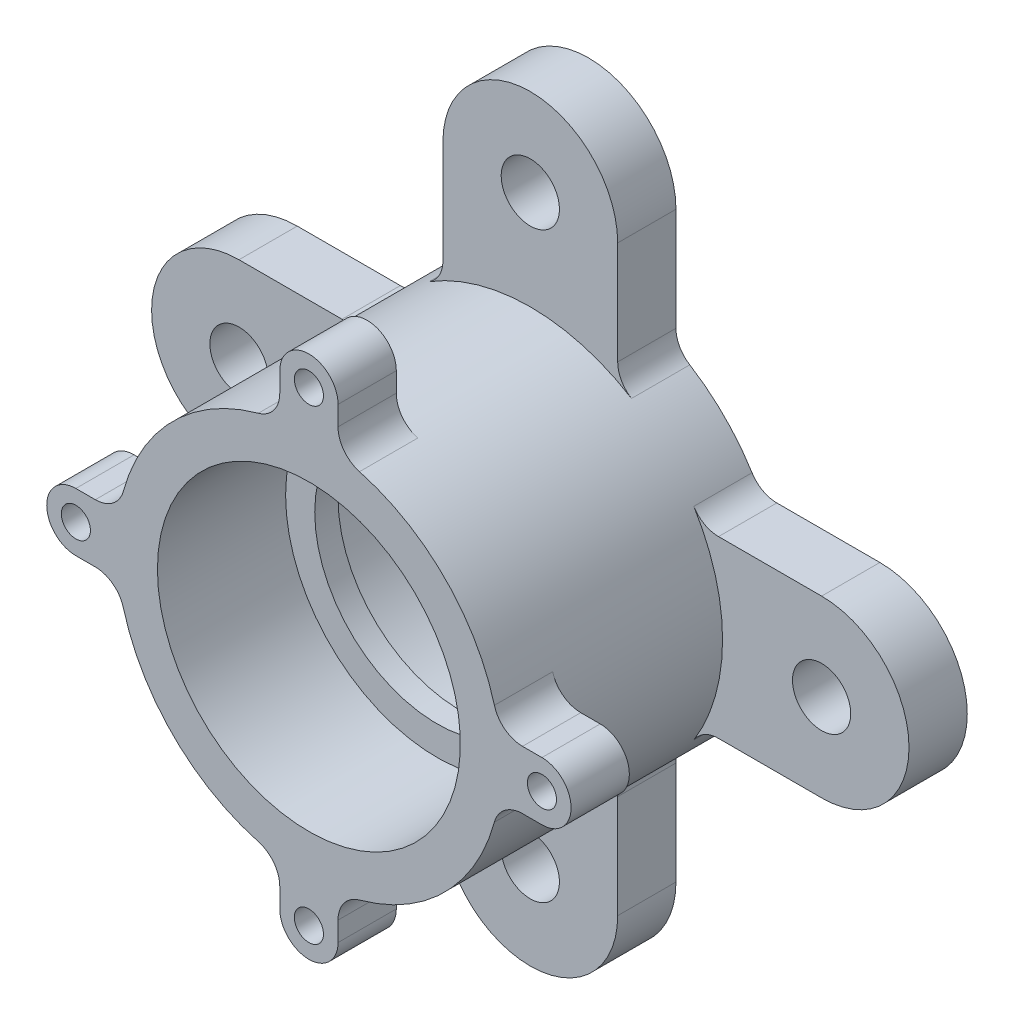
from build123d import *

# Parameters (mm, degrees)
SKETCH2_W           = 5
SKETCH2_H           = 4
BOSS_EXTRUDE1_START = -10
BOSS_EXTRUDE1_DEPTH = 10
SKETCH4_R           = 2.5
BOSS_EXTRUDE2_DEPTH = 10
FILLET1_R           = 5


with BuildPart() as part:
    # Sketch2 → Revolve1 (revolve)
    with BuildSketch(Plane(origin=(0, 0, 0), x_dir=(-1, 0, 0), z_dir=(0, 1, 0))):
        with Locations((23.5, 24)):
            Rectangle(SKETCH2_W, SKETCH2_H)
        Polygon((26, 22), (26, 0), (33, 0), (33, 48), (26, 48), (26, 26), align=None)
    revolve(axis=Axis((0, 0, 0), (0, 0, 1)))

    # Sketch3 → Boss-Extrude1 (add)
    with BuildSketch(Plane(origin=(0, 0, 0), x_dir=(1, 0, 0), z_dir=(0, 0, -1)).offset(BOSS_EXTRUDE1_START)):
        with BuildLine():
            ThreePointArc((-35, 0), (-39.393398282, 10.606601718), (-50, 15))
            Line((-50, 15), (-50, 5))
            ThreePointArc((-50, 5), (-46.464466094, 3.535533906), (-45, 0))
            ThreePointArc((-45, 0), (-46.464466094, -3.535533906), (-50, -5))
            Line((-50, -5), (-50, -15))
            ThreePointArc((-50, -15), (-39.393398282, -10.606601718), (-35, 0))
        make_face()
        with BuildLine():
            Line((-50, 5), (-50, 15))
            ThreePointArc((-50, 15), (-65, 0), (-50, -15))
            Line((-50, -15), (-50, -5))
            ThreePointArc((-50, -5), (-55, 0), (-50, 5))
        make_face()
        with BuildLine():
            ThreePointArc((-29.393876913, -15), (-33, 0), (-29.393876913, 15))
            Line((-29.393876913, 15), (-50, 15))
            ThreePointArc((-50, 15), (-39.393398282, 10.606601718), (-35, 0))
            ThreePointArc((-35, 0), (-39.393398282, -10.606601718), (-50, -15))
            Line((-50, -15), (-29.393876913, -15))
        make_face()
        with BuildLine():
            ThreePointArc((15, 50), (0, 65), (-15, 50))
            Line((-15, 50), (-5, 50))
            ThreePointArc((-5, 50), (0, 55), (5, 50))
            Line((5, 50), (15, 50))
        make_face()
        with BuildLine():
            ThreePointArc((-15, 50), (-10.606601718, 39.393398282), (0, 35))
            Line((0, 35), (0, 45))
            ThreePointArc((0, 45), (-3.535533906, 46.464466094), (-5, 50))
            Line((-5, 50), (-15, 50))
        make_face()
        with BuildLine():
            Line((0, 45), (0, 35))
            ThreePointArc((0, 35), (10.606601718, 39.393398282), (15, 50))
            Line((15, 50), (5, 50))
            ThreePointArc((5, 50), (3.535533906, 46.464466094), (0, 45))
        make_face()
        with BuildLine():
            Line((0, 35), (0, 33))
            ThreePointArc((0, 33), (7.713691135, 32.085806349), (15, 29.393876913))
            Line((15, 29.393876913), (15, 50))
            ThreePointArc((15, 50), (10.606601718, 39.393398282), (0, 35))
        make_face()
        with BuildLine():
            ThreePointArc((-15, 29.393876913), (-7.713691135, 32.085806349), (0, 33))
            Line((0, 33), (0, 35))
            ThreePointArc((0, 35), (-10.606601718, 39.393398282), (-15, 50))
            Line((-15, 50), (-15, 29.393876913))
        make_face()
        with BuildLine():
            ThreePointArc((65, 0), (60.606601718, 10.606601718), (50, 15))
            Line((50, 15), (50, 5))
            ThreePointArc((50, 5), (53.535533906, 3.535533906), (55, 0))
            ThreePointArc((55, 0), (53.535533906, -3.535533906), (50, -5))
            Line((50, -5), (50, -15))
            ThreePointArc((50, -15), (60.606601718, -10.606601718), (65, 0))
        make_face()
        with BuildLine():
            Line((50, 5), (50, 15))
            ThreePointArc((50, 15), (35, 0), (50, -15))
            Line((50, -15), (50, -5))
            ThreePointArc((50, -5), (45, 0), (50, 5))
        make_face()
        with BuildLine():
            Line((50, 15), (29.393876913, 15))
            ThreePointArc((29.393876913, 15), (32.085806349, 7.713691135), (33, 0))
            ThreePointArc((33, 0), (32.085806349, -7.713691135), (29.393876913, -15))
            Line((29.393876913, -15), (50, -15))
            ThreePointArc((50, -15), (35, 0), (50, 15))
        make_face()
        with BuildLine():
            ThreePointArc((15, -29.393876913), (0, -33), (-15, -29.393876913))
            Line((-15, -29.393876913), (-15, -50))
            ThreePointArc((-15, -50), (0, -35), (15, -50))
            Line((15, -50), (15, -29.393876913))
        make_face()
        with BuildLine():
            ThreePointArc((15, -50), (0, -35), (-15, -50))
            Line((-15, -50), (-5, -50))
            ThreePointArc((-5, -50), (0, -45), (5, -50))
            Line((5, -50), (15, -50))
        make_face()
        with BuildLine():
            Line((-5, -50), (-15, -50))
            ThreePointArc((-15, -50), (0, -65), (15, -50))
            Line((15, -50), (5, -50))
            ThreePointArc((5, -50), (0, -55), (-5, -50))
        make_face()
    extrude(amount=BOSS_EXTRUDE1_DEPTH)

    # Sketch4 → Boss-Extrude2 (add)
    # profile 1 of 4: a face of its own
    with BuildSketch(Plane.XY.offset(48)):
        with BuildLine():
            Line((-5, 29.987917986), (5, 29.987917986))
            Line((5, 29.987917986), (5, 40))
            ThreePointArc((5, 40), (0, 45), (-5, 40))
            Line((-5, 40), (-5, 29.987917986))
        make_face()
        with Locations((0, 40)):
            Circle(SKETCH4_R, mode=Mode.SUBTRACT)
    # profile 2 of 4: a face of its own
    with BuildSketch(Plane.XY.offset(48)):
        with BuildLine():
            Line((29.987917986, 5), (29.987917986, -5))
            Line((29.987917986, -5), (40, -5))
            ThreePointArc((40, -5), (45, 0), (40, 5))
            Line((40, 5), (29.987917986, 5))
        make_face()
        with Locations((40, 0)):
            Circle(SKETCH4_R, mode=Mode.SUBTRACT)
    # profile 3 of 4: a face of its own
    with BuildSketch(Plane.XY.offset(48)):
        with BuildLine():
            Line((5, -29.987917986), (-5, -29.987917986))
            Line((-5, -29.987917986), (-5, -40))
            ThreePointArc((-5, -40), (0, -45), (5, -40))
            Line((5, -40), (5, -29.987917986))
        make_face()
        with Locations((0, -40)):
            Circle(SKETCH4_R, mode=Mode.SUBTRACT)
    # profile 4 of 4: a face of its own
    with BuildSketch(Plane.XY.offset(48)):
        with BuildLine():
            Line((-29.987917986, -5), (-29.987917986, 5))
            Line((-29.987917986, 5), (-40, 5))
            ThreePointArc((-40, 5), (-45, 0), (-40, -5))
            Line((-40, -5), (-29.987917986, -5))
        make_face()
        with Locations((-40, 0)):
            Circle(SKETCH4_R, mode=Mode.SUBTRACT)
    extrude(amount=-BOSS_EXTRUDE2_DEPTH)

    # Fillet1
    fillet1_edges = [part.edges().sort_by_distance(p)[0] for p in [
        (-32.619012861, 5, 43),
        (-32.619012861, -5, 43),
        (5, 32.619012861, 43),
        (-5, 32.619012861, 43),
        (32.619012861, -5, 43),
        (32.619012861, 5, 43),
        (-29.393876913, -15, 5),
        (-29.393876913, 15, 5),
        (15, -29.393876913, 5),
        (-15, -29.393876913, 5),
        (29.393876913, 15, 5),
        (29.393876913, -15, 5),
        (-15, 29.393876913, 5),
        (15, 29.393876913, 5),
        (-5, -32.619012861, 43),
        (5, -32.619012861, 43),
    ]]
    fillet(fillet1_edges, radius=FILLET1_R)


solid = part.part
